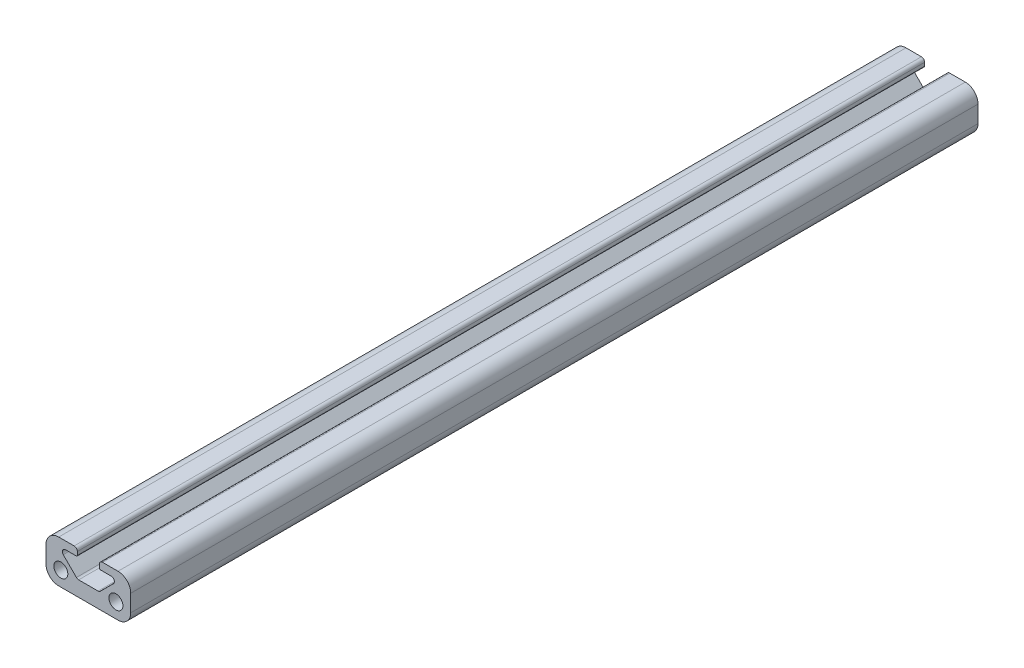
from build123d import *

# Parameters (mm, degrees)
SKETCH1_R            = 1.65
BOSS_EXTRUDE1_DEPTH  = 100
M5_CLEARANCE_HOLE1_D = 5.2


with BuildPart() as part:
    # Sketch1 → Boss-Extrude1 (new, symmetric)
    with BuildSketch(Plane.XY):
        with BuildLine():
            Line((-7, 10), (-3.35, 10))
            ThreePointArc((-3.35, 10), (-2.819669914, 9.780330086), (-2.6, 9.25))
            Line((-2.6, 9.25), (-2.6, 8.45))
            ThreePointArc((-2.6, 8.45), (-2.673223305, 8.273223305), (-2.85, 8.2))
            Line((-2.85, 8.2), (-5.389339828, 8.2))
            ThreePointArc((-5.389339828, 8.2), (-6.082249478, 7.737012574), (-5.919669914, 6.919669914))
            Line((-5.919669914, 6.919669914), (-2.819669914, 3.819669914))
            ThreePointArc((-2.819669914, 3.819669914), (-2.576352402, 3.657090351), (-2.289339828, 3.6))
            Line((-2.289339828, 3.6), (2.289339828, 3.6))
            ThreePointArc((2.289339828, 3.6), (2.576352402, 3.657090351), (2.819669914, 3.819669914))
            Line((2.819669914, 3.819669914), (5.919669914, 6.919669914))
            ThreePointArc((5.919669914, 6.919669914), (6.082249478, 7.737012574), (5.389339828, 8.2))
            Line((5.389339828, 8.2), (2.85, 8.2))
            ThreePointArc((2.85, 8.2), (2.673223305, 8.273223305), (2.6, 8.45))
            Line((2.6, 8.45), (2.6, 9.25))
            ThreePointArc((2.6, 9.25), (2.819669914, 9.780330086), (3.35, 10))
            Line((3.35, 10), (7, 10))
            ThreePointArc((7, 10), (9.121320344, 9.121320344), (10, 7))
            Line((10, 7), (10, 3))
            ThreePointArc((10, 3), (9.121320344, 0.878679656), (7, 0))
            Line((7, 0), (-7, 0))
            ThreePointArc((-7, 0), (-9.121320344, 0.878679656), (-10, 3))
            Line((-10, 3), (-10, 7))
            ThreePointArc((-10, 7), (-9.121320344, 9.121320344), (-7, 10))
        make_face()
        with Locations((-6.5, 3.5)):
            Circle(SKETCH1_R, mode=Mode.SUBTRACT)
        with Locations((6.5, 3.5)):
            Circle(SKETCH1_R, mode=Mode.SUBTRACT)
    extrude(amount=BOSS_EXTRUDE1_DEPTH, both=True)

    # M5 Clearance Hole1 (through all)
    with Locations(Plane(origin=(0, 0, 0), x_dir=(-1, 0, 0), z_dir=(0, -1, 0))):
        with Locations((0, 40), (0, -40)):
            Hole(M5_CLEARANCE_HOLE1_D / 2)


solid = part.part
